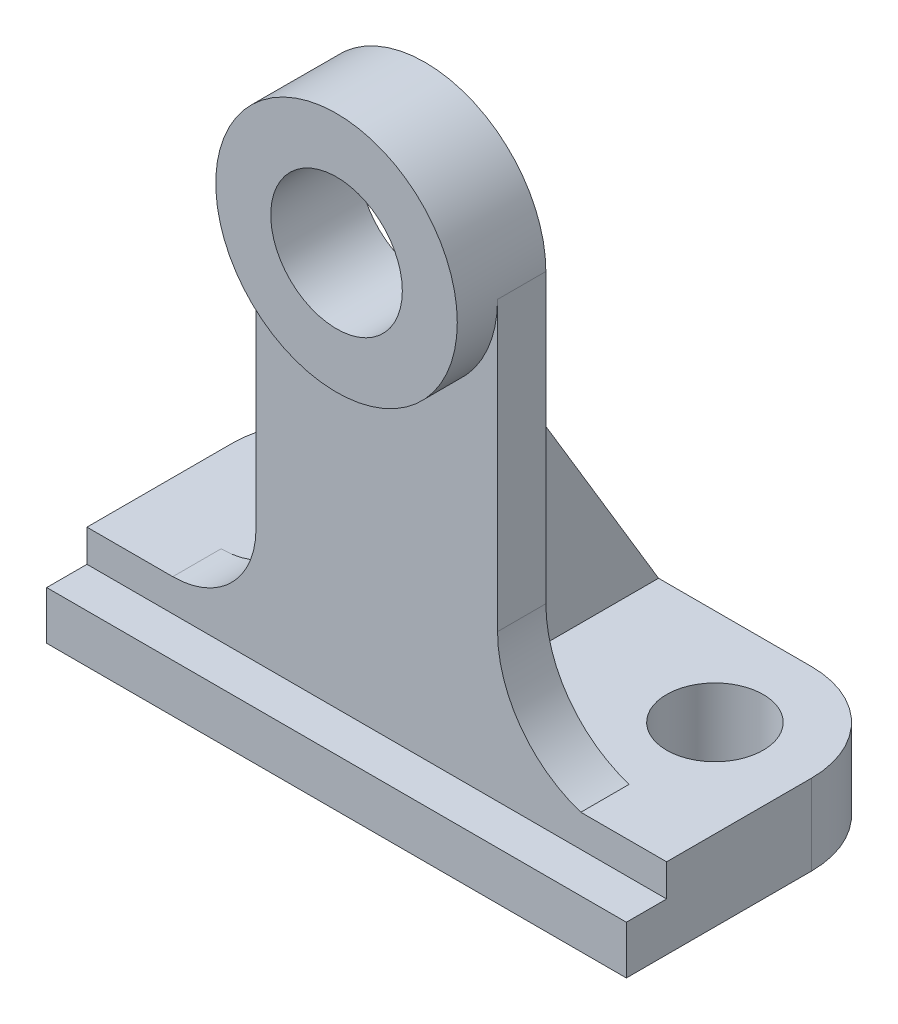
from build123d import *

# Parameters (mm, degrees)
BOSS_EXTRUDE1_DEPTH = 72
BOSS_EXTRUDE4_DEPTH = 6
SKETCH5_3_R         = 8.173204637
CUT_EXTRUDE1_DEPTH  = 6
BOSS_EXTRUDE6_START = 5
SKETCH7_R           = 15
BOSS_EXTRUDE6_DEPTH = 5
CUT_EXTRUDE3_START  = 5
SKETCH5_6_R         = 8.173204637
CUT_EXTRUDE3_DEPTH  = 5
RIB6_REACH          = 87.013
SKETCH18_WALL_W     = 218.674083686
SKETCH18_WALL_H     = 10
SKETCH20_R          = 6
CUT_EXTRUDE5_DEPTH  = 99.565967758
FILLET12_R          = 12


with BuildPart() as part:
    # Sketch2 → Boss-Extrude1 (new body)
    with BuildSketch(Plane(origin=(0, 0, 0), x_dir=(0, 0, -1), z_dir=(1, 0, 0))):
        Polygon((-17.5, 0), (-17.5, 6), (-12.5, 6), (-12.5, 10), (17.5, 10), (17.5, 0), align=None)
    extrude(amount=BOSS_EXTRUDE1_DEPTH)

    # Sketch5 → Boss-Extrude4 (add)
    with BuildSketch(Plane.XY.offset(12.5)):
        with BuildLine():
            Line((21, 60), (21, 20.340753373))
            ThreePointArc((21, 20.340753373), (17.971263459, 13.028736541), (10.659246627, 10))
            Line((10.659246627, 10), (61.340753373, 10))
            ThreePointArc((61.340753373, 10), (53.857333501, 15.45146146), (51, 24.258030049))
            Line((51, 24.258030049), (51, 60))
            ThreePointArc((51, 60), (36, 75), (21, 60))
        make_face()
    extrude(amount=-BOSS_EXTRUDE4_DEPTH)

    # Sketch5<3> → Cut-Extrude1 (cut)
    with BuildSketch(Plane.XY.offset(12.5)):
        with Locations((36, 60)):
            Circle(SKETCH5_3_R)
    extrude(amount=-CUT_EXTRUDE1_DEPTH, mode=Mode.SUBTRACT)

    # Sketch7 → Boss-Extrude6 (add)
    with BuildSketch(Plane.XY.offset(12.5).offset(BOSS_EXTRUDE6_START)):
        with Locations((36, 60)):
            Circle(SKETCH7_R)
    extrude(amount=-BOSS_EXTRUDE6_DEPTH)

    # Sketch5<6> → Cut-Extrude3 (cut)
    with BuildSketch(Plane.XY.offset(12.5).offset(CUT_EXTRUDE3_START)):
        with Locations((36, 60)):
            Circle(SKETCH5_6_R)
    extrude(amount=-CUT_EXTRUDE3_DEPTH, mode=Mode.SUBTRACT)

    # Sketch18 wall → Rib6 (add, up to next)
    with BuildSketch(Plane(origin=(36, 30, -5.5), x_dir=(0, -0.857492925713, -0.514495755428), z_dir=(0, 0.514495755428, -0.857492925713)), mode=Mode.PRIVATE) as rib6_sk1:
        Rectangle(SKETCH18_WALL_W, SKETCH18_WALL_H)
    rib6_tool1 = extrude(rib6_sk1.sketch, amount=-RIB6_REACH, mode=Mode.PRIVATE) - part.part
    add(rib6_tool1.solids().sort_by_distance((36, 30, -5.5))[0])

    # Sketch20 → Cut-Extrude5 (cut, through all)
    with BuildSketch(Plane(origin=(0, 10, 0), x_dir=(1, 0, 0), z_dir=(0, 1, 0))):
        with Locations((12, 5.5)):
            Circle(SKETCH20_R)
        with Locations((60, 5.5)):
            Circle(SKETCH20_R)
    extrude(amount=-CUT_EXTRUDE5_DEPTH, mode=Mode.SUBTRACT)

    # Fillet12
    fillet12_edges = [part.edges().sort_by_distance(p)[0] for p in [
        (72, 5, -17.5),
        (0, 5, -17.5),
    ]]
    fillet(fillet12_edges, radius=FILLET12_R)


solid = part.part
